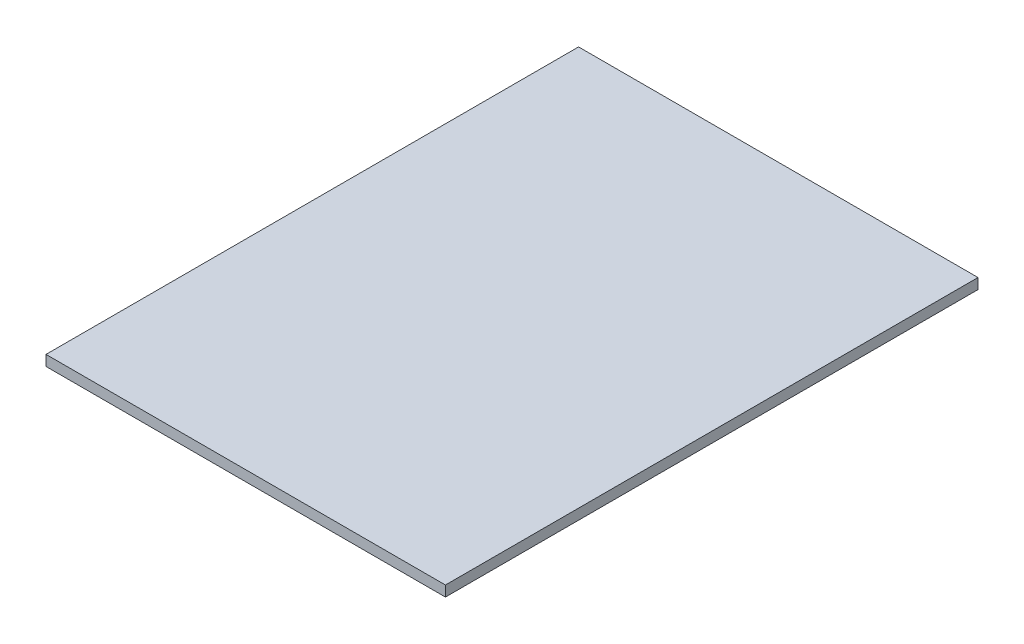
from build123d import *

# Parameters (mm, degrees)
SKETCH1_W           = 76.2
SKETCH1_H           = 2
BOSS_EXTRUDE1_DEPTH = 101.6


with BuildPart() as part:
    # Sketch1 → Boss-Extrude1 (new body)
    with BuildSketch(Plane.XY):
        with Locations((-33.433333333, 0.321428571)):
            Rectangle(SKETCH1_W, SKETCH1_H)
    extrude(amount=BOSS_EXTRUDE1_DEPTH)


solid = part.part
